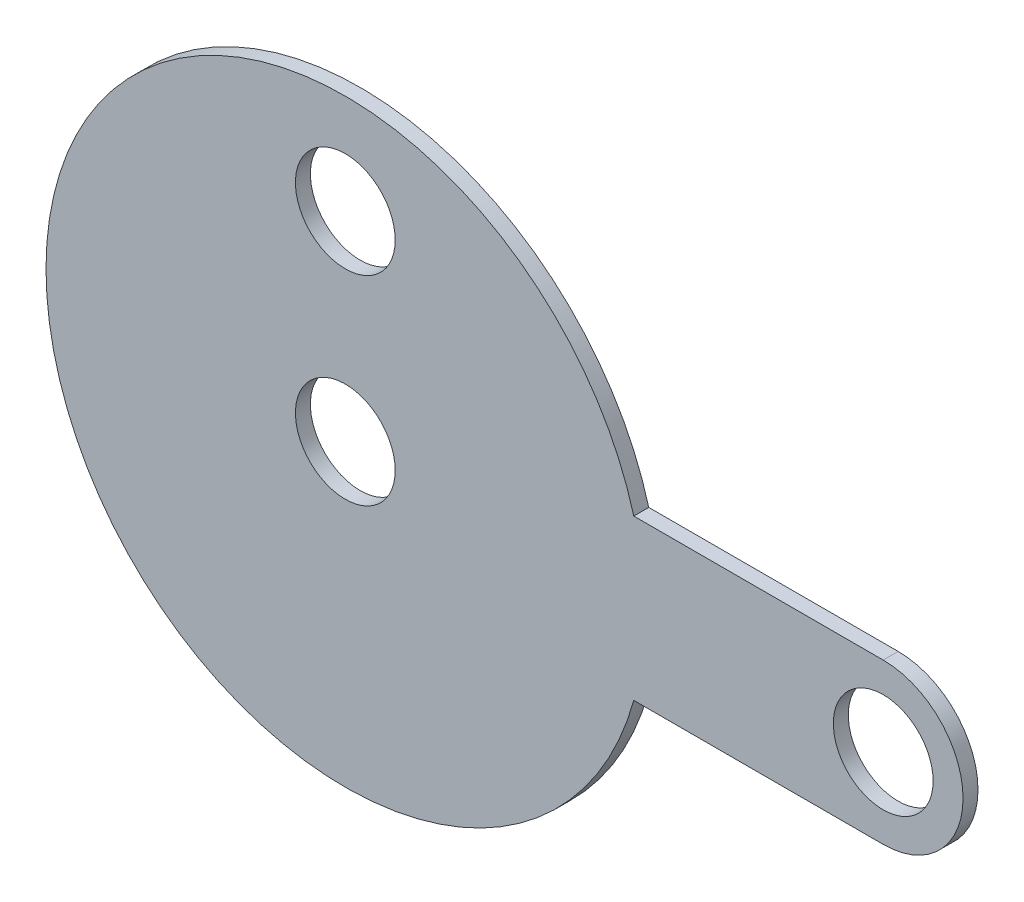
from build123d import *

# Parameters (mm, degrees)
SKETCH1_R           = 5
BOSS_EXTRUDE1_DEPTH = 1.5


with BuildPart() as part:
    # Sketch1 → Boss-Extrude1 (new body)
    with BuildSketch(Plane.XY):
        with BuildLine():
            Line((28.91366459, 8), (53.91366459, 8))
            ThreePointArc((53.91366459, 8), (61.913664472, 0), (53.91366459, -8))
            Line((53.91366459, -8), (28.91366459, -8))
            ThreePointArc((28.91366459, -8), (-30, 0), (28.91366459, 8))
        make_face()
        Circle(SKETCH1_R, mode=Mode.SUBTRACT)
        with Locations((53.913664472, 0)):
            Circle(SKETCH1_R, mode=Mode.SUBTRACT)
        with Locations((0, 20)):
            Circle(SKETCH1_R, mode=Mode.SUBTRACT)
    extrude(amount=BOSS_EXTRUDE1_DEPTH)


solid = part.part
